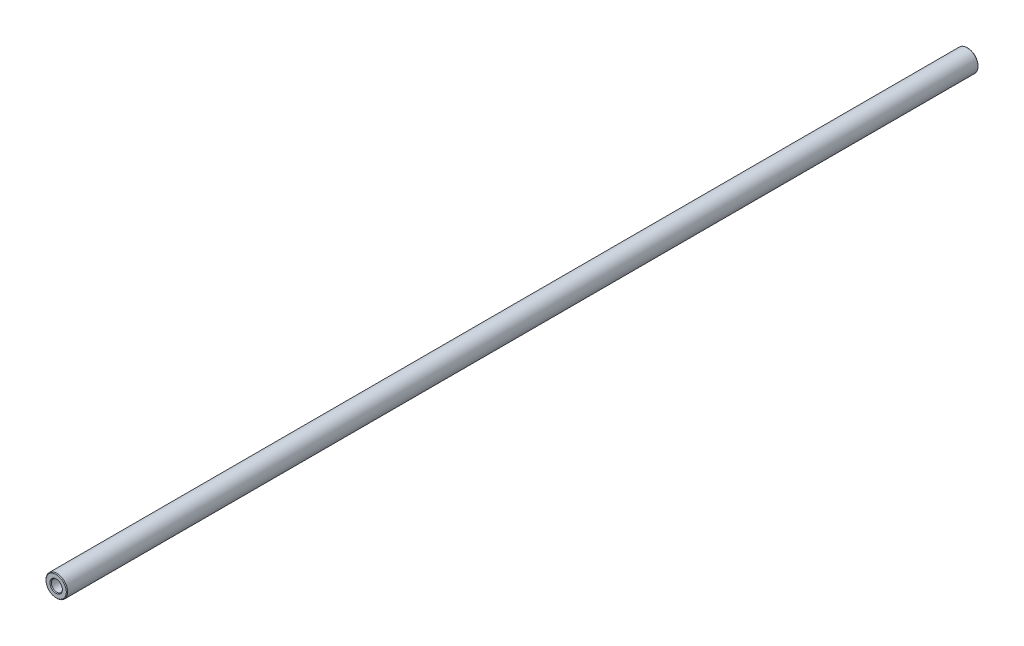
from build123d import *

# Parameters (mm, degrees)
SKETCH1_R           = 3.96875
BOSS_EXTRUDE1_DEPTH = 333.375
SKETCH2_R           = 2.032
CUT_EXTRUDE1_DEPTH  = 12.7
CUT_EXTRUDE2_START  = -12.7
SKETCH3_R           = 2.032
CUT_EXTRUDE2_DEPTH  = 12.7
CHAMFER1_SIZE       = 0.254


with BuildPart() as part:
    # Sketch1 → Boss-Extrude1 (new body)
    with BuildSketch(Plane.XY):
        Circle(SKETCH1_R)
    extrude(amount=BOSS_EXTRUDE1_DEPTH)

    # Sketch2 → Cut-Extrude1 (cut)
    with BuildSketch(Plane.XY.offset(333.375)):
        Circle(SKETCH2_R)
    extrude(amount=-CUT_EXTRUDE1_DEPTH, mode=Mode.SUBTRACT)

    # Sketch3 → Cut-Extrude2 (cut)
    with BuildSketch(Plane(origin=(0, 0, 0), x_dir=(-1, 0, 0), z_dir=(0, 0, -1)).offset(CUT_EXTRUDE2_START)):
        with Locations(Location((0, 0, 0), (0, 0, 180))):
            Circle(SKETCH3_R)
    extrude(amount=CUT_EXTRUDE2_DEPTH, mode=Mode.SUBTRACT)

    # Chamfer1
    chamfer1_edges = [part.edges().sort_by_distance(p)[0] for p in [
        (-2.032, 0, 0),
        (-3.96875, 0, 0),
        (-3.96875, 0, 333.375),
        (-2.032, 0, 333.375),
    ]]
    chamfer(chamfer1_edges, length=CHAMFER1_SIZE)


solid = part.part
